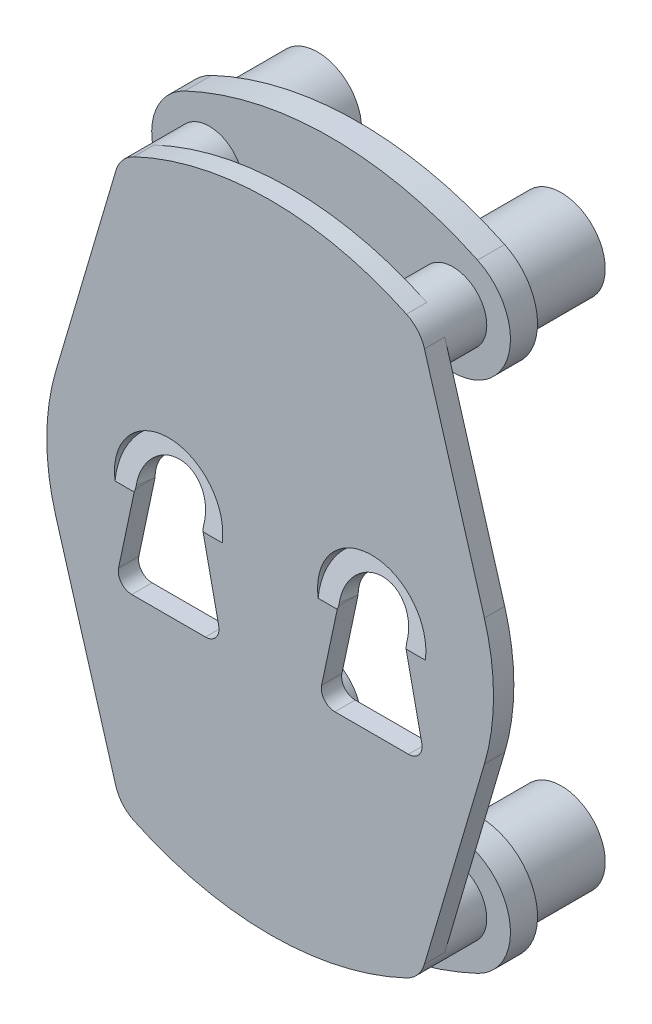
from build123d import *

# Parameters (mm, degrees)
BOSS_EXTRUDE1_DEPTH     = 20
BOSS_EXTRUDE1_2_DEPTH   = 20
SKETCH2_R               = 25
BOSS_EXTRUDE2_DEPTH     = 30
BOSS_EXTRUDE3_DEPTH     = 15
CUT_EXTRUDE1_DEPTH      = 40
CUT_EXTRUDE1_DEPTH_BACK = 51
SKETCH4_R               = 25
SKETCH5_R               = 40
CUT_EXTRUDE2_DEPTH      = 27
SKETCH6_R               = 32.5
BOSS_EXTRUDE4_DEPTH     = 60


with BuildPart() as part:
    # Sketch1 → Boss-Extrude1 (new body)
    with BuildSketch(Plane.XY):
        with BuildLine():
            ThreePointArc((-108.214285714, -1031.864254516), (-116.246402213, -1103.690520511), (-48.376068528, -1078.848113469))
            ThreePointArc((-48.376068528, -1078.848113469), (0, -1072.5), (48.376068528, -1078.848113469))
            ThreePointArc((48.376068528, -1078.848113469), (116.246402213, -1103.690520511), (108.214285714, -1031.864254516))
            ThreePointArc((108.214285714, -1031.864254516), (0, -1007.5), (-108.214285714, -1031.864254516))
        make_face()
    extrude(amount=BOSS_EXTRUDE1_DEPTH)



with BuildPart() as body_2:
    # Sketch1 → Boss-Extrude1 2 (new body)
    with BuildSketch(Plane.XY):
        with BuildLine():
            ThreePointArc((108.214285714, -1488.135745484), (116.246402213, -1416.309479489), (48.376068528, -1441.151886531))
            ThreePointArc((48.376068528, -1441.151886531), (0, -1447.5), (-48.376068528, -1441.151886531))
            ThreePointArc((-48.376068528, -1441.151886531), (-116.246402213, -1416.309479489), (-108.214285714, -1488.135745484))
            ThreePointArc((-108.214285714, -1488.135745484), (0, -1512.5), (108.214285714, -1488.135745484))
        make_face()
    extrude(amount=BOSS_EXTRUDE1_2_DEPTH)


with BuildPart() as part_1:
    add(part.part)

    add(body_2.part)  # Boss-Extrude2 merges body 2
    # Sketch2 → Boss-Extrude2 (add)
    with BuildSketch(Plane.XY.offset(20)):
        with Locations((90, -1070.26334039)):
            Circle(SKETCH2_R)
        with Locations(Location((-90, -1070.26334039, 0), (0, 0, 180))):
            Circle(SKETCH2_R)
        with Locations((-90, -1449.73665961)):
            Circle(SKETCH2_R)
        with Locations(Location((90, -1449.73665961, 0), (0, 0, 180))):
            Circle(SKETCH2_R)
    extrude(amount=BOSS_EXTRUDE2_DEPTH)

    # Sketch3 → Boss-Extrude3 (add)
    with BuildSketch(Plane.XY.offset(50)):
        with BuildLine():
            Line((-113.978732885, -1063.190832404), (-158.259637044, -1213.321447293))
            ThreePointArc((-158.259637044, -1213.321447293), (-165, -1260), (-158.259637044, -1306.678552707))
            Line((-158.259637044, -1306.678552707), (-113.978732885, -1456.809167596))
            ThreePointArc((-113.978732885, -1456.809167596), (-109.002148875, -1465.982223255), (-100.714285714, -1472.324357183))
            ThreePointArc((-100.714285714, -1472.324357183), (0, -1495), (100.714285714, -1472.324357183))
            ThreePointArc((100.714285714, -1472.324357183), (109.002148875, -1465.982223255), (113.978732885, -1456.809167596))
            Line((113.978732885, -1456.809167596), (158.259637044, -1306.678552707))
            ThreePointArc((158.259637044, -1306.678552707), (165, -1260), (158.259637044, -1213.321447293))
            Line((158.259637044, -1213.321447293), (113.978732885, -1063.190832404))
            ThreePointArc((113.978732885, -1063.190832404), (109.002148875, -1054.017776745), (100.714285714, -1047.675642817))
            ThreePointArc((100.714285714, -1047.675642817), (0, -1025), (-100.714285714, -1047.675642817))
            ThreePointArc((-100.714285714, -1047.675642817), (-109.002148875, -1054.017776745), (-113.978732885, -1063.190832404))
        make_face()
        with BuildLine():
            Line((-100, -1260), (-111.986322799, -1316.391215143))
            ThreePointArc((-111.986322799, -1316.391215143), (-109.976306406, -1324.763535962), (-102.204846792, -1328.470332051))
            Line((-102.204846792, -1328.470332051), (-47.795153208, -1328.470332051))
            ThreePointArc((-47.795153208, -1328.470332051), (-40.023693594, -1324.763535962), (-38.013677201, -1316.391215143))
            Line((-38.013677201, -1316.391215143), (-50, -1260))
            ThreePointArc((-50, -1260), (-75, -1235), (-100, -1260))
        make_face(mode=Mode.SUBTRACT)
        with BuildLine():
            Line((100, -1260), (111.986322799, -1316.391215143))
            ThreePointArc((111.986322799, -1316.391215143), (109.976306406, -1324.763535962), (102.204846792, -1328.470332051))
            Line((102.204846792, -1328.470332051), (47.795153208, -1328.470332051))
            ThreePointArc((47.795153208, -1328.470332051), (40.023693594, -1324.763535962), (38.013677201, -1316.391215143))
            Line((38.013677201, -1316.391215143), (50, -1260))
            ThreePointArc((50, -1260), (75, -1235), (100, -1260))
        make_face(mode=Mode.SUBTRACT)
    extrude(amount=BOSS_EXTRUDE3_DEPTH)

    # Sketch4 → Cut-Extrude1 (cut, two sides: drawn at the far end of the back side and taken through both)
    with BuildSketch(Plane(origin=(0, -66.479313163, -248.104174377), x_dir=(-1, 0, 0), z_dir=(0, 0.25881904510252135, 0.9659258262890681)).offset(-CUT_EXTRUDE1_DEPTH_BACK)):
        with Locations((-75, 1230.027041119)):
            Circle(SKETCH4_R)
        with Locations((75, 1230.027041119)):
            Circle(SKETCH4_R)
    extrude(amount=CUT_EXTRUDE1_DEPTH + CUT_EXTRUDE1_DEPTH_BACK, mode=Mode.SUBTRACT)

    # Sketch5 → Cut-Extrude2 (cut)
    with BuildSketch(Plane(origin=(0, -61.302932261, -228.785657851), x_dir=(-1, 0, 0), z_dir=(0, 0.25881904510252135, 0.9659258262890681))):
        with Locations((-75, 1230.027041119)):
            Circle(SKETCH5_R)
        with Locations((75, 1230.027041119)):
            Circle(SKETCH5_R)
    extrude(amount=-CUT_EXTRUDE2_DEPTH, mode=Mode.SUBTRACT)

    # Sketch6 → Boss-Extrude4 (add)
    with BuildSketch(Plane(origin=(0, 0, 0), x_dir=(-1, 0, 0), z_dir=(0, 0, -1))):
        with Locations(Location((90, -1070.26334039, 0), (0, 0, 180))):
            Circle(SKETCH6_R)
        with Locations(Location((-90, -1070.26334039, 0), (0, 0, 180))):
            Circle(SKETCH6_R)
        with Locations(Location((-90, -1449.73665961, 0), (0, 0, 180))):
            Circle(SKETCH6_R)
        with Locations(Location((90, -1449.73665961, 0), (0, 0, 180))):
            Circle(SKETCH6_R)
    extrude(amount=BOSS_EXTRUDE4_DEPTH)


solid = part_1.part
